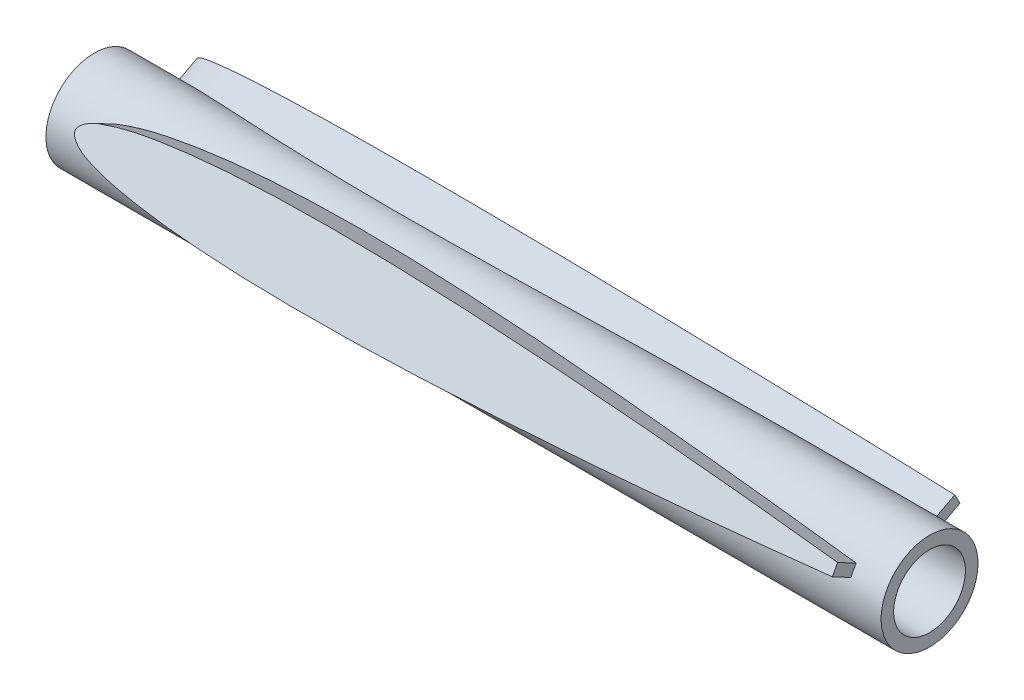
from build123d import *

# Parameters (mm, degrees)
EXTRUDE_1_DEPTH      = 190
EXTRUDE_1_DEPTH_BACK = 10
SKETCH_6_R           = 11.6
SKETCH_6_R_2         = 8.6
EXTRUDE_2_REACH      = 194.784
EXTRUDE_2_END_RADIUS = 11.6


with BuildPart() as part:
    # Эскиз6 → Бобышка-Вытянуть1 (new, two sides: drawn at the far end of the back side and taken through both)
    with BuildSketch(Plane(origin=(0, 0, 0), x_dir=(0, 0, -1), z_dir=(1, 0, 0)).offset(-EXTRUDE_1_DEPTH_BACK)):
        with Locations((-14.656930041, -7.793227942)):
            Circle(SKETCH_6_R)
        with Locations((-14.656930041, -7.793227942)):
            Circle(SKETCH_6_R_2, mode=Mode.SUBTRACT)
    extrude(amount=EXTRUDE_1_DEPTH + EXTRUDE_1_DEPTH_BACK)

    # Бобышка-Вытянуть2: up to this cylinder (the profile starts outside it)
    extrude_2_end = Plane(origin=(80.99793, -7.793227942, 14.656930041), z_dir=(1, 0, 0)) * Cylinder(EXTRUDE_2_END_RADIUS, 413.768, mode=Mode.PRIVATE)
    # Эскиз5 → Бобышка-Вытянуть2 (add, up to the surface)
    with BuildSketch(Plane(origin=(0, 0, 0), x_dir=(-1, 0, 0), z_dir=(0, -0.46947156278589147, 0.8829475928589267)), mode=Mode.PRIVATE) as extrude_2_sk1:
        with BuildLine():
            Line((-182, -1.331404921), (-182, 1.331404921))
            add(Edge.make_bspline(
                [(0, 0), (0, 0.935502638), (-2.27255633, 2.575925139), (-5.556771363, 3.642454712), (-9.737509568, 4.687162463), (-14.603656057, 5.487341662), (-21.113008927, 6.313420575), (-29.237058106, 7.005349565), (-38.995662394, 7.497703972), (-48.748351471, 7.755020887), (-61.750574897, 7.849257289), (-78.005067187, 7.610745658), (-97.505866771, 6.926671458), (-117.00605402, 5.970408057), (-136.50584792, 4.792830297), (-156.006422045, 3.439041438), (-171.170177646, 2.251181479), (-179.833667096, 1.518726568), (-182, 1.331404921)],
                knots=[0.5, 0.5, 0.5, 0.5, 0.508804888, 0.515439546, 0.528209398, 0.540779549, 0.553268654, 0.578140525, 0.602949076, 0.62773306, 0.652508673, 0.70206263, 0.751640903, 0.801249026, 0.850887776, 0.900556598, 0.950258285, 0.966833902, 0.966833902, 0.966833902, 0.966833902], degree=3))
            add(Edge.make_bspline(
                [(-182, -1.331404921), (-179.833667096, -1.518726568), (-171.170177646, -2.251181479), (-156.006422045, -3.439041438), (-136.50584792, -4.792830297), (-117.00605402, -5.970408057), (-97.505866771, -6.926671458), (-78.005067187, -7.610745658), (-61.750574897, -7.849257289), (-48.748351471, -7.755020887), (-38.995662394, -7.497703972), (-29.237058106, -7.005349565), (-21.113008927, -6.313420575), (-14.603656057, -5.487341662), (-9.737509568, -4.687162463), (-5.556771363, -3.642454712), (-2.27255633, -2.575925139), (0, -0.935502638), (0, 0)],
                knots=[0.033166098, 0.033166098, 0.033166098, 0.033166098, 0.049741715, 0.099443402, 0.149112224, 0.198750974, 0.248359097, 0.29793737, 0.347491327, 0.37226694, 0.397050924, 0.421859475, 0.446731346, 0.459220451, 0.471790602, 0.484560454, 0.491195112, 0.5, 0.5, 0.5, 0.5], degree=3))
        make_face()
    extrude_2_tool1 = extrude(extrude_2_sk1.sketch, amount=EXTRUDE_2_REACH, mode=Mode.PRIVATE) - extrude_2_end
    extrude_2 = extrude_2_tool1.solids().sort_by_distance((80.99793, 0, 0))[0]
    add(extrude_2)

    # Зеркальное отражение1: Бобышка-Вытянуть2 across plane
    add(extrude_2.mirror(Plane.XY.offset(14.656930041)))


solid = part.part
